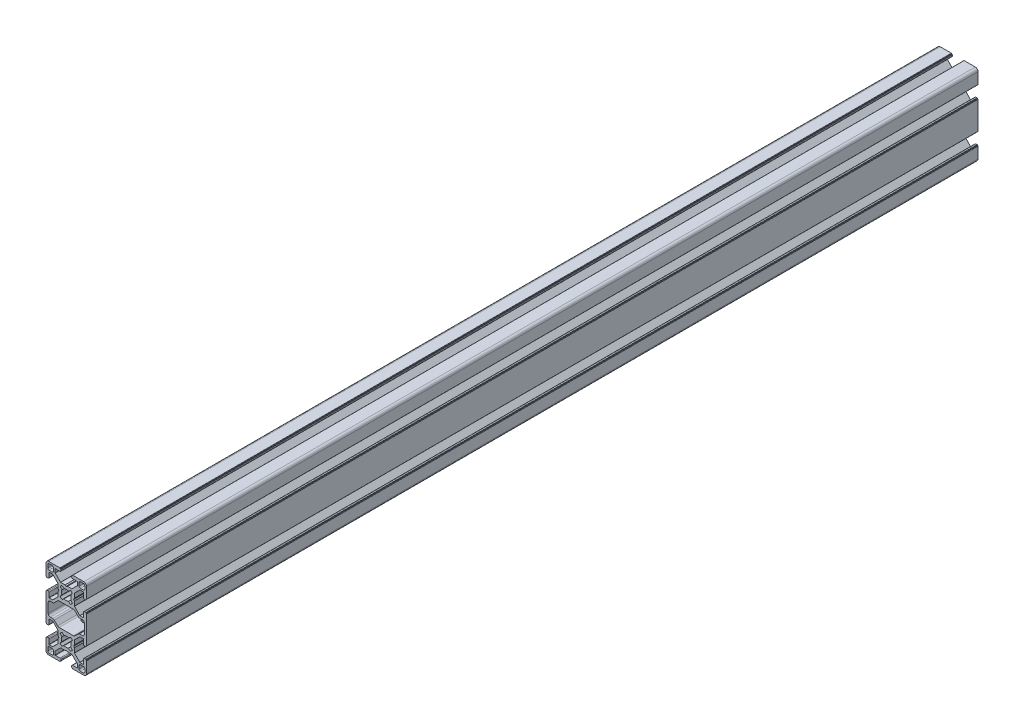
from build123d import *

# Parameters (mm, degrees)
BOSS_EXTRUDE1_DEPTH = 660
SKETCH2_R           = 3
CUT_EXTRUDE1_DEPTH  = 639.004702177
SKETCH3_R           = 3
CUT_EXTRUDE2_DEPTH  = 638.298988017


with BuildPart() as part:
    # Sketch1 → Boss-Extrude1 (new body)
    with BuildSketch(Plane.XY.offset(25)):
        with BuildLine():
            Line((13.400000821, -25.95), (14.300000334, -25.95))
            ThreePointArc((14.300000334, -25.95), (14.44142169, -25.891421356), (14.500000334, -25.75))
            Line((14.500000334, -25.75), (14.500000334, -25.65))
            ThreePointArc((14.500000334, -25.65), (14.558578978, -25.508578644), (14.700000334, -25.45))
            Line((14.700000334, -25.45), (14.8, -25.45))
            ThreePointArc((14.8, -25.45), (14.941421356, -25.391421356), (15, -25.25))
            Line((15, -25.25), (15, -4.75))
            ThreePointArc((15, -4.75), (14.941421356, -4.608578644), (14.8, -4.55))
            Line((14.8, -4.55), (14.700000334, -4.55))
            ThreePointArc((14.700000334, -4.55), (14.558578978, -4.491421356), (14.500000334, -4.35))
            Line((14.500000334, -4.35), (14.500000334, -4.25))
            ThreePointArc((14.500000334, -4.25), (14.44142169, -4.108578644), (14.300000334, -4.05))
            Line((14.300000334, -4.05), (13.400000821, -4.05))
            ThreePointArc((13.400000821, -4.05), (12.975736752, -4.225735931), (12.800000821, -4.65))
            Line((12.800000821, -4.65), (12.800000821, -8.05))
            ThreePointArc((12.800000821, -8.05), (12.741422177, -8.191421356), (12.600000821, -8.25))
            Line((12.600000821, -8.25), (10.132847586, -8.25))
            ThreePointArc((10.132847586, -8.25), (10.056310912, -8.234775911), (9.991426248, -8.191421374))
            Line((9.991426248, -8.191421374), (6.06304592, -4.263042046))
            ThreePointArc((6.06304592, -4.263042046), (6.019691356, -4.19815737), (6.004467258, -4.121620672))
            Line((6.004467258, -4.121620672), (6.004467258, -0.90000009))
            Line((6.004467258, -0.90000009), (5.542586948, -0.099999736))
            ThreePointArc((5.542586948, -0.099999736), (5.515792105, 0), (5.542586948, 0.099999736))
            Line((5.542586948, 0.099999736), (6.004467258, 0.90000009))
            Line((6.004467258, 0.90000009), (6.004467258, 4.121623437))
            ThreePointArc((6.004467258, 4.121623437), (6.019691347, 4.198160112), (6.063045884, 4.263044775))
            Line((6.063045884, 4.263044775), (9.991421447, 8.191421338))
            ThreePointArc((9.991421447, 8.191421338), (10.056306123, 8.234775902), (10.132842821, 8.25))
            Line((10.132842821, 8.25), (12.600000821, 8.25))
            ThreePointArc((12.600000821, 8.25), (12.741422177, 8.191421356), (12.800000821, 8.05))
            Line((12.800000821, 8.05), (12.800000821, 4.65))
            ThreePointArc((12.800000821, 4.65), (12.975736752, 4.225735931), (13.400000821, 4.05))
            Line((13.400000821, 4.05), (14.300000334, 4.05))
            ThreePointArc((14.300000334, 4.05), (14.44142169, 4.108578644), (14.500000334, 4.25))
            Line((14.500000334, 4.25), (14.500000334, 4.350000125))
            ThreePointArc((14.500000334, 4.350000125), (14.558578978, 4.491421481), (14.700000334, 4.550000125))
            Line((14.700000334, 4.550000125), (14.8, 4.550000125))
            ThreePointArc((14.8, 4.550000125), (14.941421356, 4.608578769), (15, 4.750000125))
            Line((15, 4.750000125), (15, 13))
            ThreePointArc((15, 13), (14.414213562, 14.414213562), (13, 15))
            Line((13, 15), (4.75, 15))
            ThreePointArc((4.75, 15), (4.608578644, 14.941421356), (4.55, 14.8))
            Line((4.55, 14.8), (4.55, 14.7))
            ThreePointArc((4.55, 14.7), (4.491421356, 14.558578644), (4.35, 14.5))
            Line((4.35, 14.5), (4.25, 14.5))
            ThreePointArc((4.25, 14.5), (4.108578644, 14.441421356), (4.05, 14.3))
            Line((4.05, 14.3), (4.05, 13.4))
            ThreePointArc((4.05, 13.4), (4.225735931, 12.975735931), (4.65, 12.8))
            Line((4.65, 12.8), (8.05, 12.8))
            ThreePointArc((8.05, 12.8), (8.191421356, 12.741421356), (8.25, 12.6))
            Line((8.25, 12.6), (8.25, 10.132847492))
            ThreePointArc((8.25, 10.132847492), (8.234775904, 10.056310778), (8.191421344, 9.991426082))
            Line((8.191421344, 9.991426082), (4.258574852, 6.058578588))
            ThreePointArc((4.258574852, 6.058578588), (4.193690258, 6.015224079), (4.117153656, 6))
            Line((4.117153656, 6), (0.899999648, 6))
            Line((0.899999648, 6), (0.101934004, 5.53923672))
            ThreePointArc((0.101934004, 5.53923672), (0, 5.511923593), (-0.101934004, 5.53923672))
            Line((-0.101934004, 5.53923672), (-0.899999648, 6))
            Line((-0.899999648, 6), (-4.117156145, 6))
            ThreePointArc((-4.117156145, 6), (-4.193692724, 6.015224069), (-4.258577305, 6.058578552))
            Line((-4.258577305, 6.058578552), (-8.191421308, 9.991421554))
            ThreePointArc((-8.191421308, 9.991421554), (-8.234775894, 10.056306263), (-8.25, 10.132843))
            Line((-8.25, 10.132843), (-8.25, 12.6))
            ThreePointArc((-8.25, 12.6), (-8.191421356, 12.741421356), (-8.05, 12.8))
            Line((-8.05, 12.8), (-4.65, 12.8))
            ThreePointArc((-4.65, 12.8), (-4.225735931, 12.975735931), (-4.05, 13.4))
            Line((-4.05, 13.4), (-4.05, 14.3))
            ThreePointArc((-4.05, 14.3), (-4.108578644, 14.441421356), (-4.25, 14.5))
            Line((-4.25, 14.5), (-4.35, 14.5))
            ThreePointArc((-4.35, 14.5), (-4.491421356, 14.558578644), (-4.55, 14.7))
            Line((-4.55, 14.7), (-4.55, 14.8))
            ThreePointArc((-4.55, 14.8), (-4.608578644, 14.941421356), (-4.75, 15))
            Line((-4.75, 15), (-13, 15))
            ThreePointArc((-13, 15), (-14.414213562, 14.414213562), (-15, 13))
            Line((-15, 13), (-15, 4.750000125))
            ThreePointArc((-15, 4.750000125), (-14.941421356, 4.608578769), (-14.8, 4.550000125))
            Line((-14.8, 4.550000125), (-14.700000334, 4.550000125))
            ThreePointArc((-14.700000334, 4.550000125), (-14.558578978, 4.491421481), (-14.500000334, 4.350000125))
            Line((-14.500000334, 4.350000125), (-14.500000334, 4.25))
            ThreePointArc((-14.500000334, 4.25), (-14.44142169, 4.108578644), (-14.300000334, 4.05))
            Line((-14.300000334, 4.05), (-13.400000821, 4.05))
            ThreePointArc((-13.400000821, 4.05), (-12.975736752, 4.225735931), (-12.800000821, 4.65))
            Line((-12.800000821, 4.65), (-12.800000821, 8.05))
            ThreePointArc((-12.800000821, 8.05), (-12.741422177, 8.191421356), (-12.600000821, 8.25))
            Line((-12.600000821, 8.25), (-10.132842821, 8.25))
            ThreePointArc((-10.132842821, 8.25), (-10.056306123, 8.234775902), (-9.991421447, 8.191421338))
            Line((-9.991421447, 8.191421338), (-6.063045884, 4.263044775))
            ThreePointArc((-6.063045884, 4.263044775), (-6.019691347, 4.198160112), (-6.004467258, 4.121623437))
            Line((-6.004467258, 4.121623437), (-6.004467258, 0.90000009))
            Line((-6.004467258, 0.90000009), (-5.542586948, 0.099999736))
            ThreePointArc((-5.542586948, 0.099999736), (-5.515792105, 0), (-5.542586948, -0.099999736))
            Line((-5.542586948, -0.099999736), (-6.004467258, -0.90000009))
            Line((-6.004467258, -0.90000009), (-6.004467258, -4.121623437))
            ThreePointArc((-6.004467258, -4.121623437), (-6.019691347, -4.198160112), (-6.063045884, -4.263044775))
            Line((-6.063045884, -4.263044775), (-9.991421447, -8.191421338))
            ThreePointArc((-9.991421447, -8.191421338), (-10.056306123, -8.234775902), (-10.132842821, -8.25))
            Line((-10.132842821, -8.25), (-12.600000821, -8.25))
            ThreePointArc((-12.600000821, -8.25), (-12.741422177, -8.191421356), (-12.800000821, -8.05))
            Line((-12.800000821, -8.05), (-12.800000821, -4.65))
            ThreePointArc((-12.800000821, -4.65), (-12.975736752, -4.225735931), (-13.400000821, -4.05))
            Line((-13.400000821, -4.05), (-14.300000334, -4.05))
            ThreePointArc((-14.300000334, -4.05), (-14.44142169, -4.108578644), (-14.500000334, -4.25))
            Line((-14.500000334, -4.25), (-14.500000334, -4.35))
            ThreePointArc((-14.500000334, -4.35), (-14.558578978, -4.491421356), (-14.700000334, -4.55))
            Line((-14.700000334, -4.55), (-14.8, -4.55))
            ThreePointArc((-14.8, -4.55), (-14.941421356, -4.608578644), (-15, -4.75))
            Line((-15, -4.75), (-15, -25.25))
            ThreePointArc((-15, -25.25), (-14.941421356, -25.391421356), (-14.8, -25.45))
            Line((-14.8, -25.45), (-14.700000334, -25.45))
            ThreePointArc((-14.700000334, -25.45), (-14.558578978, -25.508578644), (-14.500000334, -25.65))
            Line((-14.500000334, -25.65), (-14.500000334, -25.75))
            ThreePointArc((-14.500000334, -25.75), (-14.44142169, -25.891421356), (-14.300000334, -25.95))
            Line((-14.300000334, -25.95), (-13.400000821, -25.95))
            ThreePointArc((-13.400000821, -25.95), (-12.975736752, -25.774264069), (-12.800000821, -25.35))
            Line((-12.800000821, -25.35), (-12.800000821, -21.95))
            ThreePointArc((-12.800000821, -21.95), (-12.741422177, -21.808578644), (-12.600000821, -21.75))
            Line((-12.600000821, -21.75), (-10.132842821, -21.75))
            ThreePointArc((-10.132842821, -21.75), (-10.056306123, -21.765224098), (-9.991421447, -21.808578662))
            Line((-9.991421447, -21.808578662), (-6.063045884, -25.736955225))
            ThreePointArc((-6.063045884, -25.736955225), (-6.019691347, -25.801839888), (-6.004467258, -25.878376563))
            Line((-6.004467258, -25.878376563), (-6.004467258, -29.09999991))
            Line((-6.004467258, -29.09999991), (-5.542586948, -29.900000264))
            ThreePointArc((-5.542586948, -29.900000264), (-5.515792105, -30), (-5.542586948, -30.099999736))
            Line((-5.542586948, -30.099999736), (-6.004467258, -30.90000009))
            Line((-6.004467258, -30.90000009), (-6.004467258, -34.121623437))
            ThreePointArc((-6.004467258, -34.121623437), (-6.019691347, -34.198160112), (-6.063045884, -34.263044775))
            Line((-6.063045884, -34.263044775), (-9.991421447, -38.191421338))
            ThreePointArc((-9.991421447, -38.191421338), (-10.056306123, -38.234775902), (-10.132842821, -38.25))
            Line((-10.132842821, -38.25), (-12.600000821, -38.25))
            ThreePointArc((-12.600000821, -38.25), (-12.741422177, -38.191421356), (-12.800000821, -38.05))
            Line((-12.800000821, -38.05), (-12.800000821, -34.65))
            ThreePointArc((-12.800000821, -34.65), (-12.975736752, -34.225735931), (-13.400000821, -34.05))
            Line((-13.400000821, -34.05), (-14.300000334, -34.05))
            ThreePointArc((-14.300000334, -34.05), (-14.44142169, -34.108578644), (-14.500000334, -34.25))
            Line((-14.500000334, -34.25), (-14.500000334, -34.350000125))
            ThreePointArc((-14.500000334, -34.350000125), (-14.558578978, -34.491421481), (-14.700000334, -34.550000125))
            Line((-14.700000334, -34.550000125), (-14.8, -34.550000125))
            ThreePointArc((-14.8, -34.550000125), (-14.941421356, -34.608578769), (-15, -34.750000125))
            Line((-15, -34.750000125), (-15, -43))
            ThreePointArc((-15, -43), (-14.414213562, -44.414213562), (-13, -45))
            Line((-13, -45), (-4.75, -45))
            ThreePointArc((-4.75, -45), (-4.608578644, -44.941421356), (-4.55, -44.8))
            Line((-4.55, -44.8), (-4.55, -44.7))
            ThreePointArc((-4.55, -44.7), (-4.491421356, -44.558578644), (-4.35, -44.5))
            Line((-4.35, -44.5), (-4.25, -44.5))
            ThreePointArc((-4.25, -44.5), (-4.108578644, -44.441421356), (-4.05, -44.3))
            Line((-4.05, -44.3), (-4.05, -43.4))
            ThreePointArc((-4.05, -43.4), (-4.225735931, -42.975735931), (-4.65, -42.8))
            Line((-4.65, -42.8), (-8.05, -42.8))
            ThreePointArc((-8.05, -42.8), (-8.191421356, -42.741421356), (-8.25, -42.6))
            Line((-8.25, -42.6), (-8.25, -40.132843))
            ThreePointArc((-8.25, -40.132843), (-8.234775894, -40.056306263), (-8.191421308, -39.991421554))
            Line((-8.191421308, -39.991421554), (-4.258577305, -36.058578552))
            ThreePointArc((-4.258577305, -36.058578552), (-4.193692724, -36.015224069), (-4.117156145, -36))
            Line((-4.117156145, -36), (-0.899999648, -36))
            Line((-0.899999648, -36), (-0.101934004, -35.53923672))
            ThreePointArc((-0.101934004, -35.53923672), (0, -35.511923593), (0.101934004, -35.53923672))
            Line((0.101934004, -35.53923672), (0.899999648, -36))
            Line((0.899999648, -36), (4.117153656, -36))
            ThreePointArc((4.117153656, -36), (4.193690258, -36.015224079), (4.258574852, -36.058578588))
            Line((4.258574852, -36.058578588), (8.191421344, -39.991426082))
            ThreePointArc((8.191421344, -39.991426082), (8.234775904, -40.056310778), (8.25, -40.132847492))
            Line((8.25, -40.132847492), (8.25, -42.6))
            ThreePointArc((8.25, -42.6), (8.191421356, -42.741421356), (8.05, -42.8))
            Line((8.05, -42.8), (4.65, -42.8))
            ThreePointArc((4.65, -42.8), (4.225735931, -42.975735931), (4.05, -43.4))
            Line((4.05, -43.4), (4.05, -44.3))
            ThreePointArc((4.05, -44.3), (4.108578644, -44.441421356), (4.25, -44.5))
            Line((4.25, -44.5), (4.35, -44.5))
            ThreePointArc((4.35, -44.5), (4.491421356, -44.558578644), (4.55, -44.7))
            Line((4.55, -44.7), (4.55, -44.8))
            ThreePointArc((4.55, -44.8), (4.608578644, -44.941421356), (4.75, -45))
            Line((4.75, -45), (13, -45))
            ThreePointArc((13, -45), (14.414213562, -44.414213562), (15, -43))
            Line((15, -43), (15, -34.750000125))
            ThreePointArc((15, -34.750000125), (14.941421356, -34.608578769), (14.8, -34.550000125))
            Line((14.8, -34.550000125), (14.700000334, -34.550000125))
            ThreePointArc((14.700000334, -34.550000125), (14.558578978, -34.491421481), (14.500000334, -34.350000125))
            Line((14.500000334, -34.350000125), (14.500000334, -34.25))
            ThreePointArc((14.500000334, -34.25), (14.44142169, -34.108578644), (14.300000334, -34.05))
            Line((14.300000334, -34.05), (13.400000821, -34.05))
            ThreePointArc((13.400000821, -34.05), (12.975736752, -34.225735931), (12.800000821, -34.65))
            Line((12.800000821, -34.65), (12.800000821, -38.05))
            ThreePointArc((12.800000821, -38.05), (12.741422177, -38.191421356), (12.600000821, -38.25))
            Line((12.600000821, -38.25), (10.132842821, -38.25))
            ThreePointArc((10.132842821, -38.25), (10.056306123, -38.234775902), (9.991421447, -38.191421338))
            Line((9.991421447, -38.191421338), (6.063045884, -34.263044775))
            ThreePointArc((6.063045884, -34.263044775), (6.019691347, -34.198160112), (6.004467258, -34.121623437))
            Line((6.004467258, -34.121623437), (6.004467258, -30.90000009))
            Line((6.004467258, -30.90000009), (5.542586948, -30.099999736))
            ThreePointArc((5.542586948, -30.099999736), (5.515792105, -30), (5.542586948, -29.900000264))
            Line((5.542586948, -29.900000264), (6.004467258, -29.09999991))
            Line((6.004467258, -29.09999991), (6.004467258, -25.878379328))
            ThreePointArc((6.004467258, -25.878379328), (6.019691356, -25.80184263), (6.06304592, -25.736957954))
            Line((6.06304592, -25.736957954), (9.991426248, -21.808578626))
            ThreePointArc((9.991426248, -21.808578626), (10.056310912, -21.765224089), (10.132847586, -21.75))
            Line((10.132847586, -21.75), (12.600000821, -21.75))
            ThreePointArc((12.600000821, -21.75), (12.741422177, -21.808578644), (12.800000821, -21.95))
            Line((12.800000821, -21.95), (12.800000821, -25.35))
            ThreePointArc((12.800000821, -25.35), (12.975736752, -25.774264069), (13.400000821, -25.95))
        make_face()
        with BuildLine():
            Line((-9.500000904, 12.700000174), (-9.500000904, 10.500000174))
            ThreePointArc((-9.500000904, 10.500000174), (-9.792894123, 9.792893393), (-10.500000904, 9.500000174))
            Line((-10.500000904, 9.500000174), (-12.700000904, 9.500000174))
            ThreePointArc((-12.700000904, 9.500000174), (-13.407107685, 9.792893393), (-13.700000904, 10.500000174))
            Line((-13.700000904, 10.500000174), (-13.700000904, 12.700000174))
            ThreePointArc((-13.700000904, 12.700000174), (-13.407107685, 13.407106955), (-12.700000904, 13.700000174))
            Line((-12.700000904, 13.700000174), (-10.500000904, 13.700000174))
            ThreePointArc((-10.500000904, 13.700000174), (-9.792894123, 13.407106955), (-9.500000904, 12.700000174))
        make_face(mode=Mode.SUBTRACT)
        with BuildLine():
            Line((12.700000904, 9.500000174), (10.500000904, 9.500000174))
            ThreePointArc((10.500000904, 9.500000174), (9.792894123, 9.792893393), (9.500000904, 10.500000174))
            Line((9.500000904, 10.500000174), (9.500000904, 12.700000174))
            ThreePointArc((9.500000904, 12.700000174), (9.792894123, 13.407106955), (10.500000904, 13.700000174))
            Line((10.500000904, 13.700000174), (12.700000904, 13.700000174))
            ThreePointArc((12.700000904, 13.700000174), (13.407107685, 13.407106955), (13.700000904, 12.700000174))
            Line((13.700000904, 12.700000174), (13.700000904, 10.500000174))
            ThreePointArc((13.700000904, 10.500000174), (13.407107685, 9.792893393), (12.700000904, 9.500000174))
        make_face(mode=Mode.SUBTRACT)
        with BuildLine():
            Line((-12.700000904, -39.500000174), (-10.500000904, -39.500000174))
            ThreePointArc((-10.500000904, -39.500000174), (-9.792894123, -39.792893393), (-9.500000904, -40.500000174))
            Line((-9.500000904, -40.500000174), (-9.500000904, -42.700000174))
            ThreePointArc((-9.500000904, -42.700000174), (-9.792894123, -43.407106955), (-10.500000904, -43.700000174))
            Line((-10.500000904, -43.700000174), (-12.700000904, -43.700000174))
            ThreePointArc((-12.700000904, -43.700000174), (-13.407107685, -43.407106955), (-13.700000904, -42.700000174))
            Line((-13.700000904, -42.700000174), (-13.700000904, -40.500000174))
            ThreePointArc((-13.700000904, -40.500000174), (-13.407107685, -39.792893393), (-12.700000904, -39.500000174))
        make_face(mode=Mode.SUBTRACT)
        with BuildLine():
            Line((9.500000904, -42.700000174), (9.500000904, -40.500000174))
            ThreePointArc((9.500000904, -40.500000174), (9.792894123, -39.792893393), (10.500000904, -39.500000174))
            Line((10.500000904, -39.500000174), (12.700000904, -39.500000174))
            ThreePointArc((12.700000904, -39.500000174), (13.407107685, -39.792893393), (13.700000904, -40.500000174))
            Line((13.700000904, -40.500000174), (13.700000904, -42.700000174))
            ThreePointArc((13.700000904, -42.700000174), (13.407107685, -43.407106955), (12.700000904, -43.700000174))
            Line((12.700000904, -43.700000174), (10.500000904, -43.700000174))
            ThreePointArc((10.500000904, -43.700000174), (9.792894123, -43.407106955), (9.500000904, -42.700000174))
        make_face(mode=Mode.SUBTRACT)
        with BuildLine():
            Line((-3.28056155, 1.600129968), (-4.518401855, 3.135928041))
            ThreePointArc((-4.518401855, 3.135928041), (-3.897156783, 3.881001031), (-3.154670945, 4.505335862))
            Line((-3.154670945, 4.505335862), (-1.600130621, 3.280561232))
            ThreePointArc((-1.600130621, 3.280561232), (0, 3.65), (1.600130621, 3.280561232))
            Line((1.600130621, 3.280561232), (3.154670945, 4.505335862))
            ThreePointArc((3.154670945, 4.505335862), (3.897156783, 3.881001031), (4.518401855, 3.135928041))
            Line((4.518401855, 3.135928041), (3.28056155, 1.600129968))
            ThreePointArc((3.28056155, 1.600129968), (3.65, 0), (3.28056155, -1.600129968))
            Line((3.28056155, -1.600129968), (4.518401855, -3.135928041))
            ThreePointArc((4.518401855, -3.135928041), (3.897156783, -3.881001031), (3.154670945, -4.505335862))
            Line((3.154670945, -4.505335862), (1.600130621, -3.280561232))
            ThreePointArc((1.600130621, -3.280561232), (0, -3.65), (-1.600130621, -3.280561232))
            Line((-1.600130621, -3.280561232), (-3.154670945, -4.505335862))
            ThreePointArc((-3.154670945, -4.505335862), (-3.897156783, -3.881001031), (-4.518401855, -3.135928041))
            Line((-4.518401855, -3.135928041), (-3.28056155, -1.600129968))
            ThreePointArc((-3.28056155, -1.600129968), (-3.65, 0), (-3.28056155, 1.600129968))
        make_face(mode=Mode.SUBTRACT)
        with BuildLine():
            Line((-4.518401855, -33.135928041), (-3.28056155, -31.600129968))
            ThreePointArc((-3.28056155, -31.600129968), (-3.65, -30), (-3.28056155, -28.399870032))
            Line((-3.28056155, -28.399870032), (-4.518401855, -26.864071959))
            ThreePointArc((-4.518401855, -26.864071959), (-3.897156783, -26.118998969), (-3.154670945, -25.494664138))
            Line((-3.154670945, -25.494664138), (-1.600130621, -26.719438768))
            ThreePointArc((-1.600130621, -26.719438768), (0, -26.35), (1.600130621, -26.719438768))
            Line((1.600130621, -26.719438768), (3.154670945, -25.494664138))
            ThreePointArc((3.154670945, -25.494664138), (3.897156783, -26.118998969), (4.518401855, -26.864071959))
            Line((4.518401855, -26.864071959), (3.28056155, -28.399870032))
            ThreePointArc((3.28056155, -28.399870032), (3.65, -30), (3.28056155, -31.600129968))
            Line((3.28056155, -31.600129968), (4.518401855, -33.135928041))
            ThreePointArc((4.518401855, -33.135928041), (3.897156783, -33.881001031), (3.154670945, -34.505335862))
            Line((3.154670945, -34.505335862), (1.600130621, -33.280561232))
            ThreePointArc((1.600130621, -33.280561232), (0, -33.65), (-1.600130621, -33.280561232))
            Line((-1.600130621, -33.280561232), (-3.154670945, -34.505335862))
            ThreePointArc((-3.154670945, -34.505335862), (-3.897156783, -33.881001031), (-4.518401855, -33.135928041))
        make_face(mode=Mode.SUBTRACT)
        with BuildLine():
            Line((8.927207746, -20.539339865), (6.410354062, -23.056193892))
            ThreePointArc((6.410354062, -23.056193892), (5.923719014, -23.381353072), (5.349693818, -23.495533793))
            Line((5.349693818, -23.495533793), (-5.349693818, -23.495533793))
            ThreePointArc((-5.349693818, -23.495533793), (-5.923719014, -23.381353072), (-6.410354062, -23.056193892))
            Line((-6.410354062, -23.056193892), (-8.927207746, -20.539339865))
            ThreePointArc((-8.927207746, -20.539339865), (-9.413842755, -20.214180712), (-9.987867904, -20.1))
            Line((-9.987867904, -20.1), (-11.849999904, -20.1))
            ThreePointArc((-11.849999904, -20.1), (-12.910660076, -19.660660172), (-13.349999904, -18.6))
            Line((-13.349999904, -18.6), (-13.349999904, -11.4))
            ThreePointArc((-13.349999904, -11.4), (-12.910660076, -10.339339828), (-11.849999904, -9.9))
            Line((-11.849999904, -9.9), (-9.987867904, -9.9))
            ThreePointArc((-9.987867904, -9.9), (-9.413842755, -9.785819288), (-8.927207746, -9.460660135))
            Line((-8.927207746, -9.460660135), (-6.410354062, -6.943806108))
            ThreePointArc((-6.410354062, -6.943806108), (-5.923719014, -6.618646928), (-5.349693818, -6.504466207))
            Line((-5.349693818, -6.504466207), (5.349693818, -6.504466207))
            ThreePointArc((5.349693818, -6.504466207), (5.923719014, -6.618646928), (6.410354062, -6.943806108))
            Line((6.410354062, -6.943806108), (8.927207746, -9.460660135))
            ThreePointArc((8.927207746, -9.460660135), (9.413842755, -9.785819288), (9.987867904, -9.9))
            Line((9.987867904, -9.9), (11.849999904, -9.9))
            ThreePointArc((11.849999904, -9.9), (12.910660076, -10.339339828), (13.349999904, -11.4))
            Line((13.349999904, -11.4), (13.349999904, -18.6))
            ThreePointArc((13.349999904, -18.6), (12.910660076, -19.660660172), (11.849999904, -20.1))
            Line((11.849999904, -20.1), (9.987867904, -20.1))
            ThreePointArc((9.987867904, -20.1), (9.413842755, -20.214180712), (8.927207746, -20.539339865))
        make_face(mode=Mode.SUBTRACT)
    extrude(amount=-BOSS_EXTRUDE1_DEPTH)

    # Sketch2 → Cut-Extrude1 (cut, through all)
    with BuildSketch(Plane(origin=(0, 15, 0), x_dir=(1, 0, 0), z_dir=(0, 1, 0))):
        with Locations(Location((0, 620, 0), (0, 0, 122.233901794))):
            Circle(SKETCH2_R)
        with Locations(Location((0, -10, 0), (0, 0, 237.766098206))):
            Circle(SKETCH2_R)
    extrude(amount=-CUT_EXTRUDE1_DEPTH, mode=Mode.SUBTRACT)

    # Sketch3 → Cut-Extrude2 (cut, through all)
    with BuildSketch(Plane(origin=(15, 0, 0), x_dir=(0, 0, -1), z_dir=(1, 0, 0))):
        with Locations(Location((305, 0, 0), (0, 0, 147.766112935))):
            Circle(SKETCH3_R)
    extrude(amount=-CUT_EXTRUDE2_DEPTH, mode=Mode.SUBTRACT)


solid = part.part
